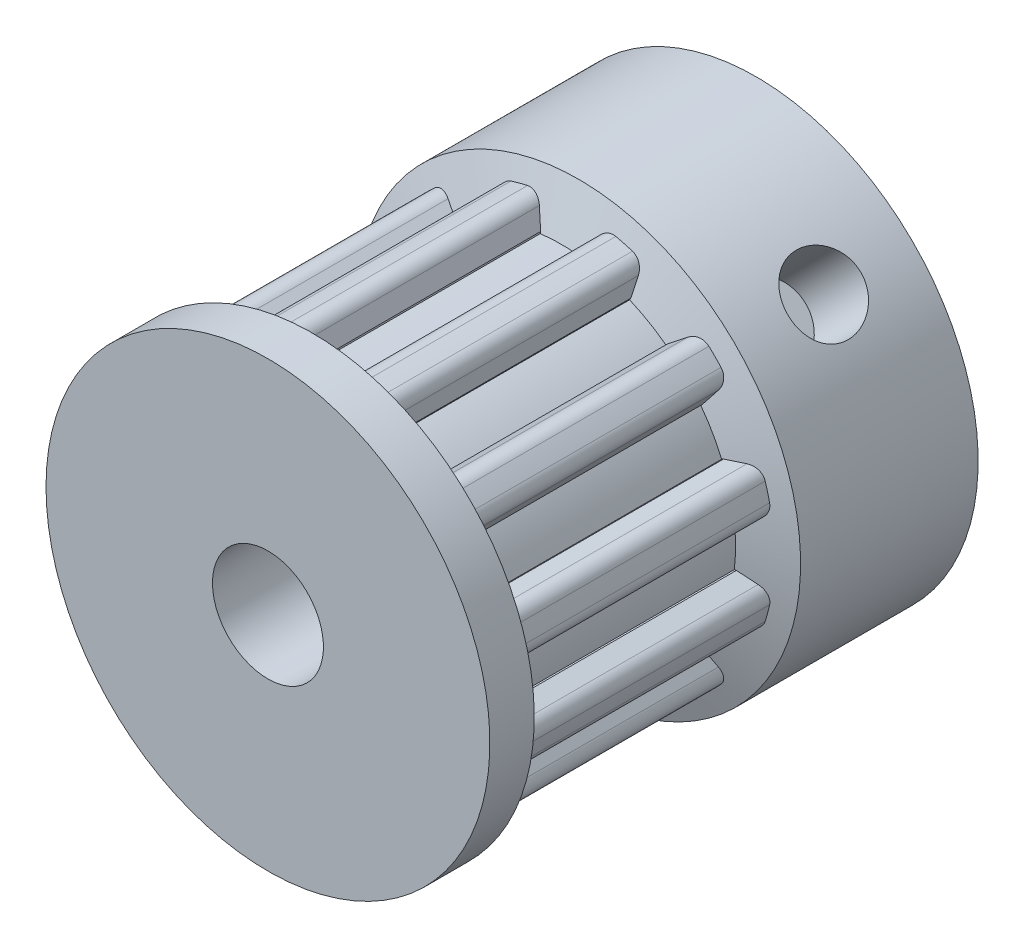
from build123d import *
from build123d.topology import SkipClean

# Parameters (mm, degrees)
BOSS_EXTRUDE1_REACH     = 28.153
CIRPATTERN1_COUNT       = 12
CUT_EXTRUDE1_DEPTH      = 27.153393738
CUT_EXTRUDE1_DEPTH_BACK = 27.153393738
SKETCH4_R               = 1.65
CUT_EXTRUDE2_START      = -3.5
CUT_EXTRUDE2_DEPTH      = 3
CIRPATTERN2_COUNT       = 2


with BuildPart() as part:
    # Sketch2 → Revolve1 (revolve)
    with BuildSketch(Plane(origin=(0, 0, 0), x_dir=(1, 0, 0), z_dir=(0, 1, 0)), mode=Mode.PRIVATE) as revolve1_sk:
        Polygon((2.5, 0), (2.5, -22), (10, -22), (10, -20), (7.8525, -19.218373922), (7.8525, -8.781626078), (10, -8), (10, 0), align=None)
    revolve(revolve1_sk.sketch.rotate(Axis((0, 0, 0), (0, 0, 1)), 180), axis=Axis((0, 0, 0), (0, 0, 1)))

    # Boss-Extrude1: up to this cone (the profile starts outside it)
    with SkipClean():  # the faces are left unmerged after this step: merging them gives an invalid solid
        boss_extrude1_end = Plane(origin=(0, 0, 22), z_dir=(0, 0, -1)).offset(10.360298657) * Cone(2.747e-06, 50.258786627, 18.292701343, align=(Align.CENTER, Align.CENTER, Align.MIN), mode=Mode.PRIVATE)
        # Sketch3 → Boss-Extrude1 (add, up to the surface)
        with BuildSketch(Plane.XY.offset(22), mode=Mode.PRIVATE) as boss_extrude1_sk1:
            with BuildLine():
                Line((4.758460703, 6.331534415), (1.501980983, 1.998512729))
                ThreePointArc((1.501980983, 1.998512729), (1.767766953, 1.767766953), (1.998512729, 1.501980983))
                Line((1.998512729, 1.501980983), (6.331534415, 4.758460703))
                Line((6.331534415, 4.758460703), (6.780916292, 5.400244534))
                ThreePointArc((6.780916292, 5.400244534), (6.89258266, 5.79999294), (6.72922132, 6.181544036))
                ThreePointArc((6.72922132, 6.181544036), (6.461188213, 6.461188213), (6.181544036, 6.72922132))
                ThreePointArc((6.181544036, 6.72922132), (5.79999294, 6.89258266), (5.400244534, 6.780916292))
                Line((5.400244534, 6.780916292), (4.758460703, 6.331534415))
            make_face()
        boss_extrude1_tool1 = extrude(boss_extrude1_sk1.sketch, amount=-BOSS_EXTRUDE1_REACH, mode=Mode.PRIVATE) - boss_extrude1_end
        boss_extrude1 = boss_extrude1_tool1.solids().sort_by_distance((4.455195, 4.455195, 22))[0]
        add(boss_extrude1)

    # CirPattern1: Boss-Extrude1 ×12 about axis
    with SkipClean():  # the faces are left unmerged after this step: merging them gives an invalid solid
        cirpattern1_axis = Axis((0, 0, 0), (0, 0, 1))
        for i in range(1, CIRPATTERN1_COUNT):
            add(boss_extrude1.rotate(cirpattern1_axis, i * 360 / CIRPATTERN1_COUNT))

    # Sketch4 → Cut-Extrude1 (cut, two sides: drawn at the far end of the back side and taken through both)
    with SkipClean():  # the faces are left unmerged after this step: merging them gives an invalid solid
        with BuildSketch(Plane(origin=(0, 0, 0), x_dir=(-0.7071067811865464, 0.7071067811865488, 0), z_dir=(0.7071067811865488, 0.7071067811865464, 0)).offset(-CUT_EXTRUDE1_DEPTH_BACK)):
            with Locations((0, 4)):
                Circle(SKETCH4_R)
        extrude(amount=CUT_EXTRUDE1_DEPTH + CUT_EXTRUDE1_DEPTH_BACK, mode=Mode.SUBTRACT)

    # Sketch5 → Cut-Extrude2 (cut)
    with SkipClean():  # the faces are left unmerged after this step: merging them gives an invalid solid
        with BuildSketch(Plane(origin=(0, 0, 0), x_dir=(-0.7071067811865464, 0.7071067811865488, 0), z_dir=(0.7071067811865488, 0.7071067811865464, 0)).offset(CUT_EXTRUDE2_START)):
            Polygon((-3.5, 0), (-3.5, 6.020725942), (0, 8.041451884), (3.5, 6.020725942), (3.5, 0), align=None)
        cut_extrude2 = extrude(amount=-CUT_EXTRUDE2_DEPTH, mode=Mode.SUBTRACT)

    # CirPattern2: Cut-Extrude2 ×2 about axis
    with SkipClean():  # the faces are left unmerged after this step: merging them gives an invalid solid
        cirpattern2_axis = Axis((0, 0, 0), (0, 0, 1))
        for i in range(1, CIRPATTERN2_COUNT):
            add(cut_extrude2.rotate(cirpattern2_axis, i * 360 / CIRPATTERN2_COUNT), mode=Mode.SUBTRACT)


solid = part.part
